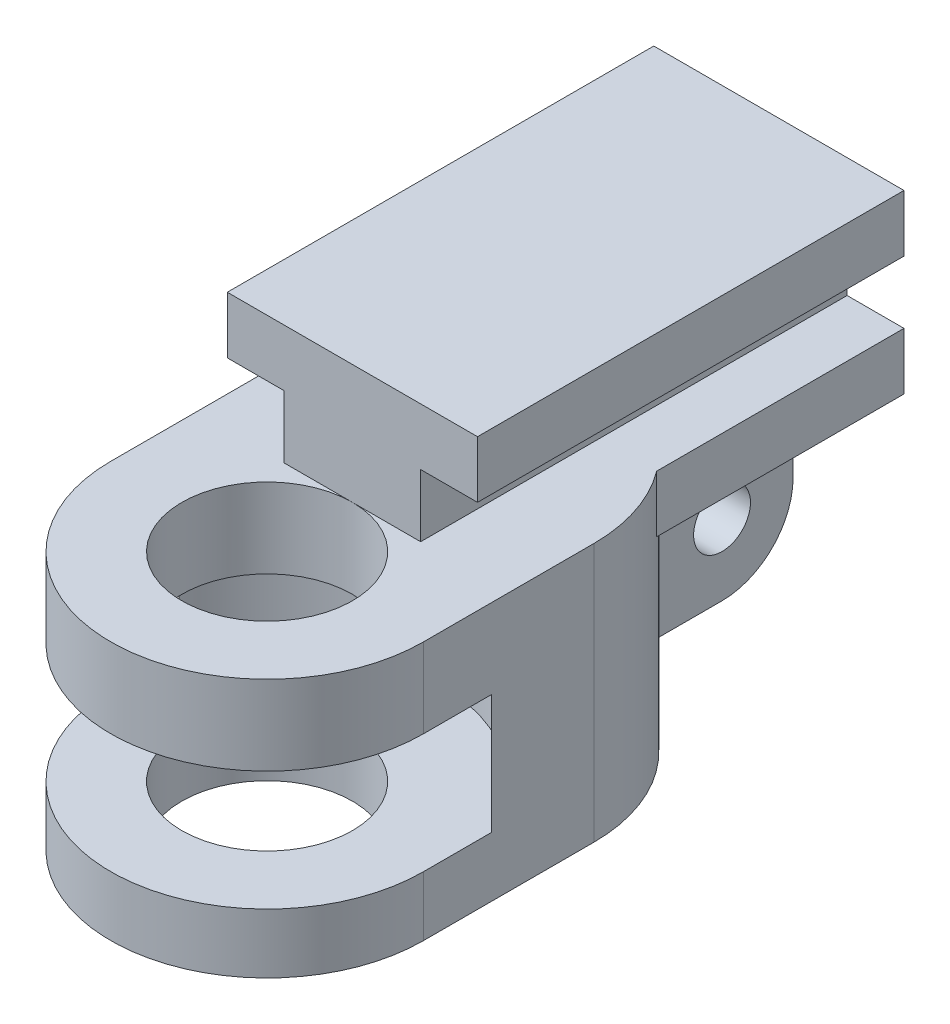
from build123d import *

# Parameters (mm, degrees)
BOSS_EXTRUDE1_DEPTH      = 15
SKETCH5_R                = 3
BOSS_EXTRUDE3_DEPTH      = 9.1
SKETCH6_R                = 6
CUT_EXTRUDE1_DEPTH       = 4.2
BOSS_EXTRUDE4_DEPTH      = 1.5
BOSS_EXTRUDE4_DEPTH_BACK = 1.5
SKETCH7_R                = 1


with BuildPart() as part:
    # Sketch1 → Boss-Extrude1 (new body)
    with BuildSketch(Plane.XY):
        Polygon((-2.4, -1.1), (-2.4, 1.1), (-4.4, 1.1), (-4.4, 3.1), (4.4, 3.1), (4.4, 1.1), (2.4, 1.1), (2.4, -1.1), (4.4, -1.1), (4.4, -3.1), (-4.4, -3.1), (-4.4, -1.1), align=None)
    extrude(amount=BOSS_EXTRUDE1_DEPTH)

    # Sketch5 → Boss-Extrude3 (add)
    with BuildSketch(Plane(origin=(0, -1.1, 0), x_dir=(1, 0, 0), z_dir=(0, 1, 0))):
        with BuildLine():
            Line((5.5, -18), (5.5, -12))
            ThreePointArc((5.5, -12), (0, -6.5), (-5.5, -12))
            Line((-5.5, -12), (-5.5, -18))
            ThreePointArc((-5.5, -18), (0, -23.5), (5.5, -18))
        make_face()
        with Locations(Location((0, -18, 0), (0, 0, 180))):
            Circle(SKETCH5_R, mode=Mode.SUBTRACT)
    extrude(amount=-BOSS_EXTRUDE3_DEPTH)

    # Sketch6 → Cut-Extrude1 (cut)
    with BuildSketch(Plane(origin=(0, -8.1, 0), x_dir=(-1, 0, 0), z_dir=(0, -1, 0))):
        with Locations((0, -18)):
            Circle(SKETCH6_R)
    extrude(amount=-CUT_EXTRUDE1_DEPTH, mode=Mode.SUBTRACT)

    # Sketch7 → Boss-Extrude4 (add, two sides: drawn at the far end of the back side and taken through both)
    with BuildSketch(Plane(origin=(0, 0, 0), x_dir=(0, 0, -1), z_dir=(1, 0, 0)).offset(-BOSS_EXTRUDE4_DEPTH_BACK)):
        with BuildLine():
            Line((-3.5, -9.1), (-6.5, -9.1))
            Line((-6.5, -9.1), (-9.5, -9.1))
            Line((-9.5, -9.1), (-9.5, -3.1))
            Line((-9.5, -3.1), (-1, -3.1))
            Line((-1, -3.1), (-1, -6.6))
            ThreePointArc((-1, -6.6), (-1.732233047, -8.367766953), (-3.5, -9.1))
        make_face()
        with Locations((-3.5, -6.6)):
            Circle(SKETCH7_R, mode=Mode.SUBTRACT)
    extrude(amount=BOSS_EXTRUDE4_DEPTH + BOSS_EXTRUDE4_DEPTH_BACK)


solid = part.part
